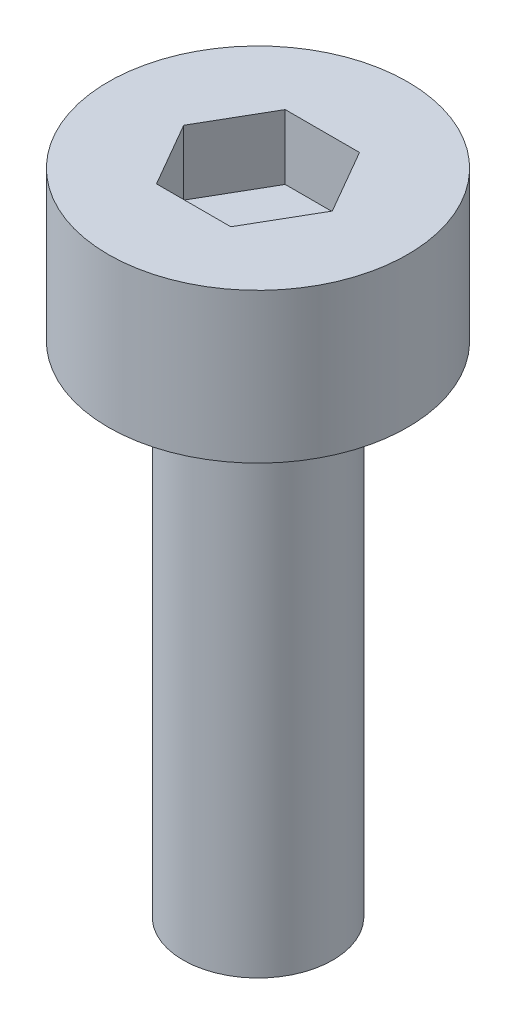
from build123d import *

# Parameters (mm, degrees)
SKETCH1_R           = 1.5
SCREWSHAFT_DEPTH    = 10
SKETCH2_R           = 3
BOSS_EXTRUDE2_DEPTH = 3
CUT_EXTRUDE1_DEPTH  = 1.3


with BuildPart() as part:
    # Sketch1 → ScrewShaft (new body)
    with BuildSketch(Plane(origin=(0, 0, 0), x_dir=(1, 0, 0), z_dir=(0, 1, 0))):
        with Locations(Location((0, 0, 0), (0, 0, 270))):
            Circle(SKETCH1_R)
    extrude(amount=SCREWSHAFT_DEPTH)

    # Sketch2 → Boss-Extrude2 (add)
    with BuildSketch(Plane(origin=(0, 10, 0), x_dir=(1, 0, 0), z_dir=(0, 1, 0))):
        with Locations(Location((0, 0, 0), (0, 0, 270))):
            Circle(SKETCH2_R)
    extrude(amount=BOSS_EXTRUDE2_DEPTH)

    # Sketch3 → Cut-Extrude1 (cut)
    with BuildSketch(Plane(origin=(0, 13, 0), x_dir=(1, 0, 0), z_dir=(0, 1, 0))):
        Polygon((1.489563695, 0), (0.744781847, 1.29), (-0.744781847, 1.29), (-1.489563695, 0), (-0.744781847, -1.29), (0.744781847, -1.29), align=None)
    extrude(amount=-CUT_EXTRUDE1_DEPTH, mode=Mode.SUBTRACT)


solid = part.part
